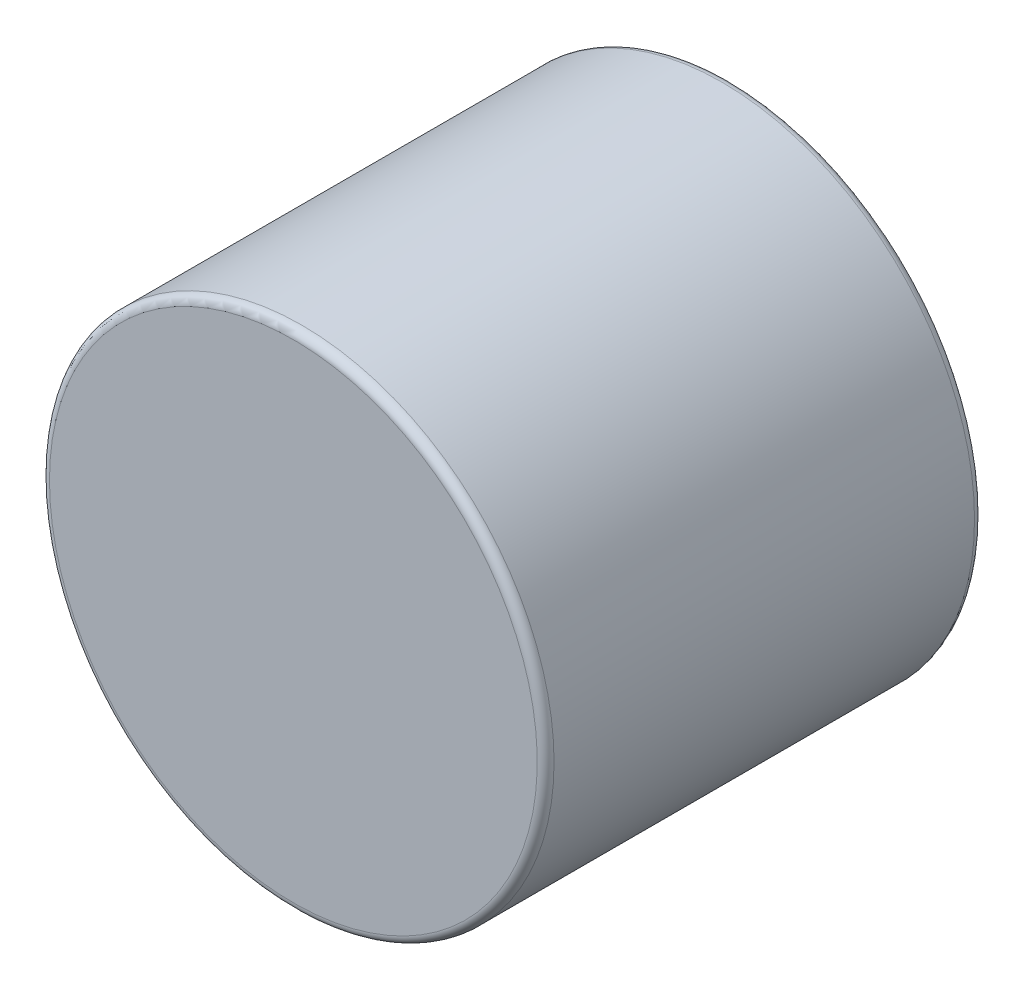
from build123d import *

# Parameters (mm, degrees)
FILLET1_R           = 12.7
SKETCH4_W           = 508
SKETCH4_H           = 508
BOSS_EXTRUDE1_DEPTH = 6.35
SKETCH5_W           = 457.2
SKETCH5_H           = 457.2
BOSS_EXTRUDE2_DEPTH = 6.35


with BuildPart() as part:
    # Sketch2 → Revolve1 (revolve)
    with BuildSketch(Plane(origin=(0, 0, 0), x_dir=(0, 0, -1), z_dir=(1, 0, 0)), mode=Mode.PRIVATE) as revolve1_sk:
        Polygon((-330.2, 0), (-330.2, 381), (330.2, 381), (330.2, 0), (325.12, 0), (325.12, 375.92), (-325.12, 375.92), (-325.12, 0), align=None)
    revolve(revolve1_sk.sketch.rotate(Axis((0, 0, 330.2), (0, 0, -1)), 90), axis=Axis((0, 0, 330.2), (0, 0, -1)))

    # Fillet1
    fillet1_edges = [part.edges().sort_by_distance(p)[0] for p in [
        (-381, 0, 330.2),
        (-381, 0, -330.2),
    ]]
    fillet(fillet1_edges, radius=FILLET1_R)


with BuildPart() as body_2:
    # Sketch4 → Boss-Extrude1 (new body)
    with BuildSketch(Plane(origin=(0, 215.9, 0), x_dir=(-1, 0, 0), z_dir=(0, 1, 0))):
        Rectangle(SKETCH4_W, SKETCH4_H)
    extrude(amount=BOSS_EXTRUDE1_DEPTH)


with BuildPart() as body_3:
    # Sketch5 → Boss-Extrude2 (new body)
    with BuildSketch(Plane(origin=(0, -292.1, 0), x_dir=(-1, 0, 0), z_dir=(0, 1, 0))):
        Rectangle(SKETCH5_W, SKETCH5_H)
    extrude(amount=BOSS_EXTRUDE2_DEPTH)


solid = Compound([part.part, body_2.part, body_3.part])
